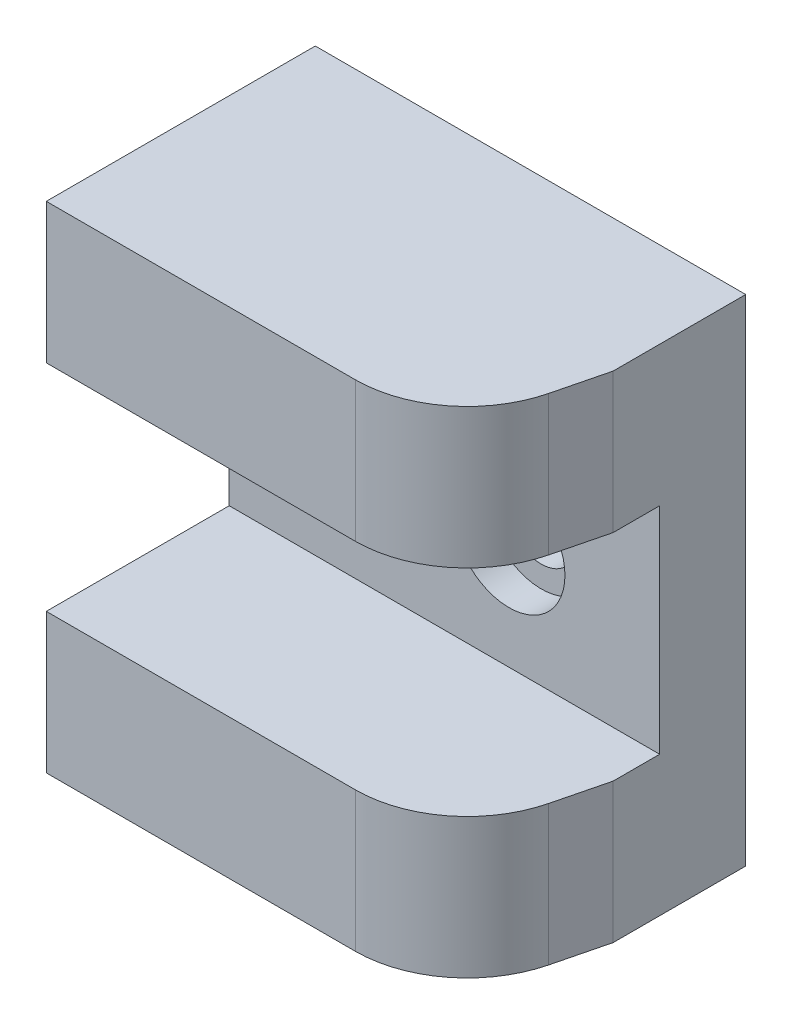
from build123d import *

# Parameters (mm, degrees)
SKETCH_1_W                   = 20
SKETCH_1_H                   = 23
EXTRUDE_1_DEPTH              = 12.5
CUT_EXTRUDE_1_DEPTH          = 26.5
SKETCH_3_W                   = 20
SKETCH_3_H                   = 10
CUT_EXTRUDE_2_DEPTH          = 8.5
HOLE_WIZARD_M3_1_D           = 3.2
HOLE_WIZARD_M3_1_CBORE_D     = 5.2
HOLE_WIZARD_M3_1_CBORE_DEPTH = 1.5


with BuildPart() as part:
    # 草图1 → 凸台-拉伸1 (new body)
    with BuildSketch(Plane.XY):
        with Locations((120, 93.5)):
            Rectangle(SKETCH_1_W, SKETCH_1_H)
    extrude(amount=EXTRUDE_1_DEPTH)

    # 草图2 → 切除-拉伸1 (cut)
    with BuildSketch(Plane(origin=(0, 105, 0), x_dir=(1, 0, 0), z_dir=(0, 1, 0))):
        with BuildLine():
            Line((129.40254033, -8.557993857), (130, -6.161714003))
            Line((130, -6.161714003), (130, -12.5))
            Line((130, -12.5), (124.357002553, -12.5))
            ThreePointArc((124.357002553, -12.5), (127.558442225, -11.397655919), (129.40254033, -8.557993857))
        make_face()
    extrude(amount=-CUT_EXTRUDE_1_DEPTH, mode=Mode.SUBTRACT)

    # 草图3 → 切除-拉伸2 (cut)
    with BuildSketch(Plane.XY.offset(12.5)):
        with Locations((120, 93.5)):
            Rectangle(SKETCH_3_W, SKETCH_3_H)
    extrude(amount=-CUT_EXTRUDE_2_DEPTH, mode=Mode.SUBTRACT)

    # M3 六角头螺栓的柱形沉头孔1 (through all)
    with Locations(Plane.XY.offset(4)):
        with Locations((115, 93.5), (123, 93.5)):
            CounterBoreHole(HOLE_WIZARD_M3_1_D / 2, HOLE_WIZARD_M3_1_CBORE_D / 2, HOLE_WIZARD_M3_1_CBORE_DEPTH)


solid = part.part
